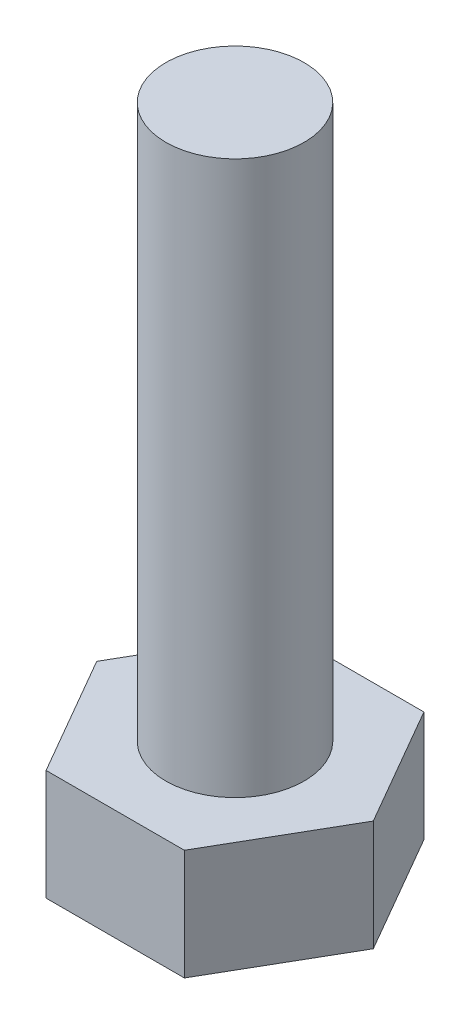
from build123d import *

# Parameters (mm, degrees)
EXTRUDE_1_DEPTH = 2
SKETCH_2_R      = 1.25
EXTRUDE_2_DEPTH = 10


with BuildPart() as part:
    # 草图1 → 凸台-拉伸1 (new body)
    with BuildSketch(Plane(origin=(0, 0, 0), x_dir=(1, 0, 0), z_dir=(0, 1, 0))):
        Polygon((1.25, 2.165063509), (-1.25, 2.165063509), (-2.5, 0), (-1.25, -2.165063509), (1.25, -2.165063509), (2.5, 0), align=None)
    extrude(amount=EXTRUDE_1_DEPTH)

    # 草图2 → 凸台-拉伸2 (add)
    with BuildSketch(Plane(origin=(0, 2, 0), x_dir=(1, 0, 0), z_dir=(0, 1, 0))):
        with Locations(Location((0, 0, 0), (0, 0, 270))):
            Circle(SKETCH_2_R)
    extrude(amount=EXTRUDE_2_DEPTH)


solid = part.part
